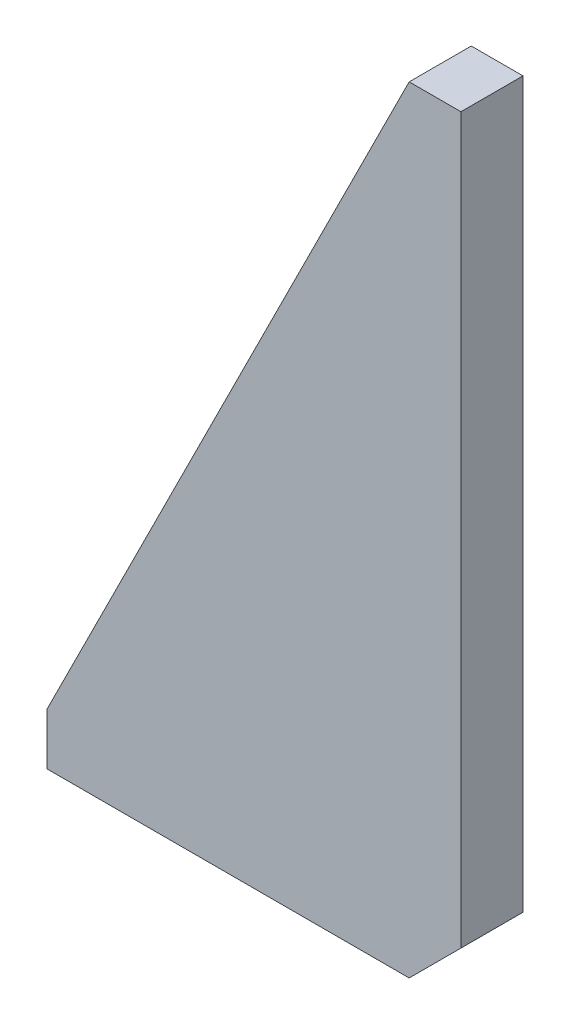
from build123d import *

# Parameters (mm, degrees)
DODANIE_WYCI_GNI_CIE1_DEPTH = 12


with BuildPart() as part:
    # Szkic1 → Dodanie-wyciągnięcie1 (new body)
    with BuildSketch(Plane.XY):
        Polygon((-80, 0), (-10, 0), (0, 10), (0, 150), (-10, 150), (-80, 10), align=None)
    extrude(amount=DODANIE_WYCI_GNI_CIE1_DEPTH)


solid = part.part
